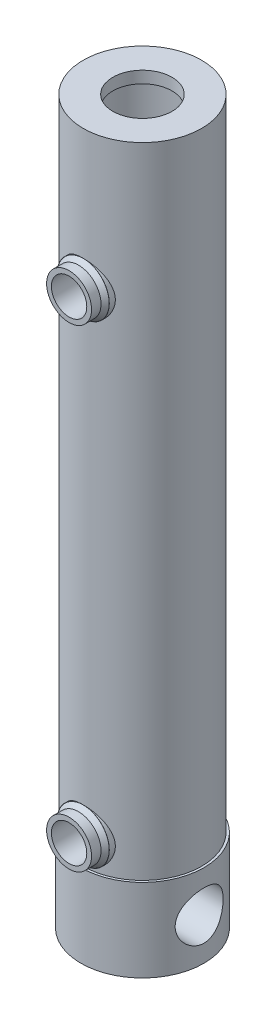
from build123d import *
from OCP.BRepFilletAPI import BRepFilletAPI_MakeChamfer

# Parameters (mm, degrees)
ESQUISSE2_R                  = 26
BOSS_EXTRU_1_DEPTH           = 35
ESQUISSE3_R                  = 7.475
ENL_V_MAT_EXTRU_2_DEPTH      = 273.492201723
ENL_V_MAT_EXTRU_3_DEPTH      = 273.492201822
ENL_V_MAT_EXTRU_3_DEPTH_BACK = 273.492201822
ESQUISSE4_R                  = 10.125
BOSS_EXTRU_2_START           = -2.550056
ESQUISSE5_R                  = 11
ESQUISSE5_R_2                = 7.475
BOSS_EXTRU_2_DEPTH           = 2.550056
ESQUISSE6_R                  = 9.5
ESQUISSE6_R_2                = 7.475
BOSS_EXTRU_3_DEPTH           = 6
CHANFREIN2_SIZE              = 2
CHANFREIN2_SIZE2             = 1.453085056


with BuildPart() as part:
    # Esquisse1 → Révolution1 (revolve)
    with BuildSketch(Plane.XY):
        Polygon((0, 0), (25, 0), (25, 270), (12.5, 270), (12.5, 265), (20, 265), (20, 3), (0, 3), align=None)
    revolve(axis=Axis((0, 3, 0), (0, 1, 0)))

    # Esquisse2 → Boss.-Extru.1 (add)
    with BuildSketch(Plane(origin=(0, 0, 0), x_dir=(-1, 0, 0), z_dir=(0, -1, 0))):
        with Locations(Location((0, 0, 0), (0, 0, 180))):
            Circle(ESQUISSE2_R)
    extrude(amount=BOSS_EXTRU_1_DEPTH)

    # Esquisse3 → Enlèv. mat.-Extru.2 (cut, through all)
    with BuildSketch(Plane.XY):
        with Locations(Location((0, 11.5, 0), (0, 0, 180))):
            Circle(ESQUISSE3_R)
        with Locations(Location((0, 211.5, 0), (0, 0, 180))):
            Circle(ESQUISSE3_R)
    extrude(amount=ENL_V_MAT_EXTRU_2_DEPTH, mode=Mode.SUBTRACT)

    # Esquisse4 → Enlèv. mat.-Extru.3 (cut, two sides: drawn at the far end of the back side and taken through both)
    with BuildSketch(Plane(origin=(0, 0, 0), x_dir=(0, 0, -1), z_dir=(1, 0, 0)).offset(-ENL_V_MAT_EXTRU_3_DEPTH_BACK)):
        with Locations(Location((0, -17.5, 0), (0, 0, 270))):
            Circle(ESQUISSE4_R)
    extrude(amount=ENL_V_MAT_EXTRU_3_DEPTH + ENL_V_MAT_EXTRU_3_DEPTH_BACK, mode=Mode.SUBTRACT)

    # Esquisse5 → Boss.-Extru.2 (add)
    # profile 1 of 2: a face of its own
    with BuildSketch(Plane.XY.offset(25).offset(BOSS_EXTRU_2_START)):
        with Locations((0, 211.5)):
            Circle(ESQUISSE5_R)
        with Locations(Location((0, 211.5, 0), (0, 0, 180))):
            Circle(ESQUISSE5_R_2, mode=Mode.SUBTRACT)
    # profile 2 of 2: a face of its own
    with BuildSketch(Plane.XY.offset(25).offset(BOSS_EXTRU_2_START)):
        with Locations((0, 11.5)):
            Circle(ESQUISSE5_R)
        with Locations(Location((0, 11.5, 0), (0, 0, 180))):
            Circle(ESQUISSE5_R_2, mode=Mode.SUBTRACT)
    extrude(amount=BOSS_EXTRU_2_DEPTH)

    # Esquisse6 → Boss.-Extru.3 (add)
    # profile 1 of 2: a face of its own
    with BuildSketch(Plane.XY.offset(25)):
        with Locations((0, 211.5)):
            Circle(ESQUISSE6_R)
        with Locations(Location((0, 211.5, 0), (0, 0, 180))):
            Circle(ESQUISSE6_R_2, mode=Mode.SUBTRACT)
    # profile 2 of 2: a face of its own
    with BuildSketch(Plane.XY.offset(25)):
        with Locations((0, 11.5)):
            Circle(ESQUISSE6_R)
        with Locations(Location((0, 11.5, 0), (0, 0, 180))):
            Circle(ESQUISSE6_R_2, mode=Mode.SUBTRACT)
    extrude(amount=BOSS_EXTRU_3_DEPTH)

    # Chanfrein2: one chamfer whose edges measure the first distance from different faces: ONE call of the kernel's chamfer builder (chamfer() names one face for all edges)
    chanfrein2_edges_1 = [part.edges().sort_by_distance(p)[0] for p in [
        (6.717514421, 204.782485579, 25),
    ]]
    chanfrein2_side_1 = [part.faces().sort_by_distance(p)[0] for p in [
        (-9.5, 211.5, 28),
    ]]
    chanfrein2_edges_2 = [part.edges().sort_by_distance(p)[0] for p in [
        (6.717514421, 4.782485579, 25),
    ]]
    chanfrein2_side_2 = [part.faces().sort_by_distance(p)[0] for p in [
        (-9.5, 11.5, 28),
    ]]
    chanfrein2 = BRepFilletAPI_MakeChamfer(part.part.solid().wrapped)
    for e in chanfrein2_edges_1:
        chanfrein2.Add(CHANFREIN2_SIZE, CHANFREIN2_SIZE2, e.wrapped, chanfrein2_side_1[0].wrapped)  # the first distance lies on this face
    for e in chanfrein2_edges_2:
        chanfrein2.Add(CHANFREIN2_SIZE, CHANFREIN2_SIZE2, e.wrapped, chanfrein2_side_2[0].wrapped)  # the first distance lies on this face
    add(Compound.cast(chanfrein2.Shape()), mode=Mode.REPLACE)


solid = part.part
